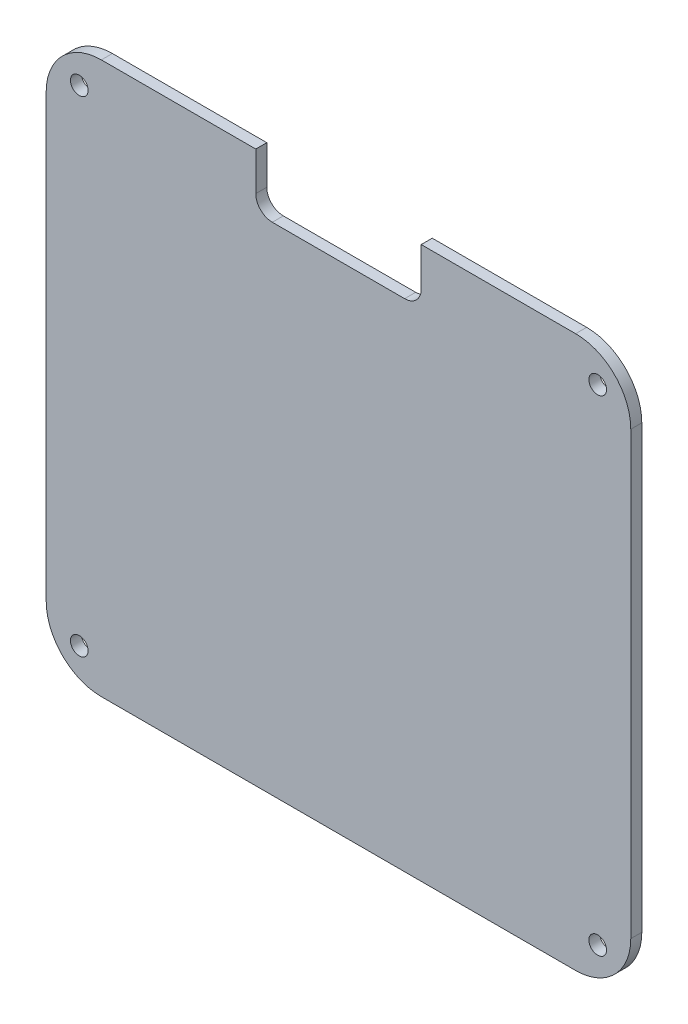
from build123d import *

# Parameters (mm, degrees)
BOSS_EXTRUDE1_DEPTH = 2
SKETCH2_W           = 30
SKETCH2_H           = 10
CUT_EXTRUDE1_DEPTH  = 364.88597115
FILLET1_R           = 3
SKETCH3_R           = 1.6
CUT_EXTRUDE2_DEPTH  = 364.88597115


with BuildPart() as part:
    # Sketch1 → Boss-Extrude1 (new body)
    with BuildSketch(Plane.XY):
        with BuildLine():
            Line((-43, 260), (43, 260))
            ThreePointArc((43, 260), (50.071067812, 262.928932188), (53, 270))
            Line((53, 270), (53, 350))
            ThreePointArc((53, 350), (50.071067812, 357.071067812), (43, 360))
            Line((43, 360), (-43, 360))
            ThreePointArc((-43, 360), (-50.071067812, 357.071067812), (-53, 350))
            Line((-53, 350), (-53, 270))
            ThreePointArc((-53, 270), (-50.071067812, 262.928932188), (-43, 260))
        make_face()
    extrude(amount=-BOSS_EXTRUDE1_DEPTH)

    # Sketch2 → Cut-Extrude1 (cut, through all)
    with BuildSketch(Plane.XY):
        with Locations((0, 355)):
            Rectangle(SKETCH2_W, SKETCH2_H)
    extrude(amount=-CUT_EXTRUDE1_DEPTH, mode=Mode.SUBTRACT)

    # Fillet1
    fillet1_edges = [part.edges().sort_by_distance(p)[0] for p in [
        (-15, 350, -1),
        (15, 350, -1),
    ]]
    fillet(fillet1_edges, radius=FILLET1_R)

    # Sketch3 → Cut-Extrude2 (cut, through all)
    with BuildSketch(Plane.XY):
        with Locations((47, 354)):
            Circle(SKETCH3_R)
        with Locations((47, 266)):
            Circle(SKETCH3_R)
        with Locations(Location((-47, 266, 0), (0, 0, 180))):
            Circle(SKETCH3_R)
        with Locations(Location((-47, 354, 0), (0, 0, 180))):
            Circle(SKETCH3_R)
    extrude(amount=-CUT_EXTRUDE2_DEPTH, mode=Mode.SUBTRACT)


solid = part.part
